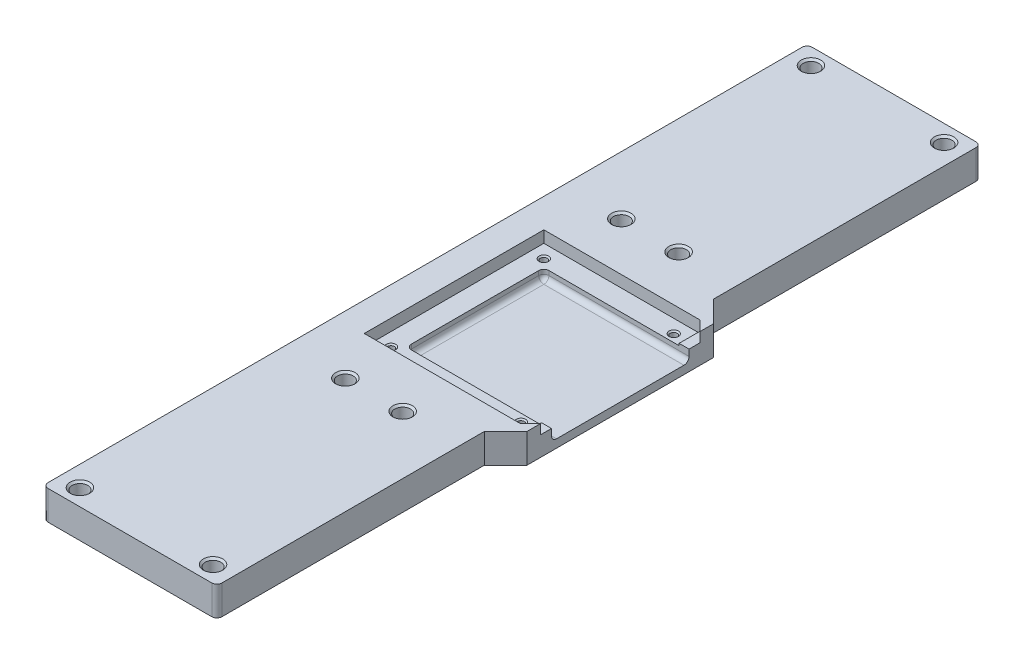
from build123d import *

# Parameters (mm, degrees)
BOSS_EXTRUDE1_DEPTH     = 11.5
SKETCH4_R               = 3.075
CUT_EXTRUDE1_DEPTH      = 6
BOSS_EXTRUDE3_DEPTH     = 11.5
CUT_EXTRUDE6_DEPTH      = 4.6
CUT_EXTRUDE3_DEPTH      = 157.057233091
CUT_EXTRUDE3_DEPTH_BACK = 3.7
SKETCH24_W              = 57
SKETCH24_H              = 54
SKETCH25_R              = 1.35
CUT_EXTRUDE4_DEPTH      = 5
CHAMFER4_SIZE           = 0.5
FILLET1_R               = 2
BOSS_EXTRUDE2_DEPTH     = 0.8
CHAMFER5_SIZE           = 0.75


with BuildPart() as part:
    # Sketch1 → Boss-Extrude1 (new body)
    with BuildSketch(Plane(origin=(0, 0, 0), x_dir=(1, 0, 0), z_dir=(0, 1, 0))):
        with BuildLine():
            Line((-34.125, 135), (-34.125, -135))
            Line((-34.125, -135), (-34.125, -148))
            ThreePointArc((-34.125, -148), (-33.539213562, -149.414213562), (-32.125, -150))
            Line((-32.125, -150), (32.125, -150))
            ThreePointArc((32.125, -150), (33.539213562, -149.414213562), (34.125, -148))
            Line((34.125, -148), (34.125, -135))
            Line((34.125, -135), (34.125, 135))
            Line((34.125, 135), (34.125, 148))
            ThreePointArc((34.125, 148), (33.539213562, 149.414213562), (32.125, 150))
            Line((32.125, 150), (-32.125, 150))
            ThreePointArc((-32.125, 150), (-33.539213562, 149.414213562), (-34.125, 148))
            Line((-34.125, 148), (-34.125, 135))
        make_face()
    extrude(amount=BOSS_EXTRUDE1_DEPTH)

    # Sketch4 → Cut-Extrude1 (cut)
    with BuildSketch(Plane(origin=(0, 11.5, 0), x_dir=(1, 0, 0), z_dir=(0, 1, 0))):
        with Locations(Location((-26.125, -143.5, 0), (0, 0, 270))):
            Circle(SKETCH4_R)
        with Locations(Location((26.125, -143.5, 0), (0, 0, 270))):
            Circle(SKETCH4_R)
        with Locations(Location((26.125, 143.5, 0), (0, 0, 270))):
            Circle(SKETCH4_R)
        with Locations(Location((-26.125, 143.5, 0), (0, 0, 270))):
            Circle(SKETCH4_R)
        with Locations(Location((-11.25, -54.175, 0), (0, 0, 270))):
            Circle(SKETCH4_R)
        with Locations(Location((11.25, -54.175, 0), (0, 0, 270))):
            Circle(SKETCH4_R)
        with Locations(Location((11.25, 54.175, 0), (0, 0, 270))):
            Circle(SKETCH4_R)
        with Locations(Location((-11.25, 54.175, 0), (0, 0, 270))):
            Circle(SKETCH4_R)
    extrude(amount=-CUT_EXTRUDE1_DEPTH, mode=Mode.SUBTRACT)

    # Sketch27 → Boss-Extrude3 (add)
    with BuildSketch(Plane(origin=(0, 11.5, 0), x_dir=(1, 0, 0), z_dir=(0, 1, 0))):
        Polygon((34.125, 45), (42.5, 36.625), (42.5, -36.625), (34.125, -45), align=None)
    extrude(amount=-BOSS_EXTRUDE3_DEPTH)

    # Sketch21 → Cut-Extrude6 (cut)
    with BuildSketch(Plane(origin=(0, 11.5, 0), x_dir=(1, 0, 0), z_dir=(0, 1, 0))):
        Polygon((42.5, 31.353553391), (42.5, -31.353553391), (38.603553391, -35.25), (-22.75, -35.25), (-22.75, 35.25), (38.603553391, 35.25), align=None)
    extrude(amount=-CUT_EXTRUDE6_DEPTH, mode=Mode.SUBTRACT)

    # Sketch24 → Cut-Extrude3 (cut, two sides: drawn at the far end of the back side and taken through both)
    with BuildSketch(Plane(origin=(0, 6.9, 0), x_dir=(1, 0, 0), z_dir=(0, 1, 0)).offset(-CUT_EXTRUDE3_DEPTH_BACK)):
        with Locations((14, 0)):
            Rectangle(SKETCH24_W, SKETCH24_H)
    extrude(amount=CUT_EXTRUDE3_DEPTH + CUT_EXTRUDE3_DEPTH_BACK, mode=Mode.SUBTRACT)

    # Sketch25 → Cut-Extrude4 (cut)
    with BuildSketch(Plane(origin=(0, 6.9, 0), x_dir=(1, 0, 0), z_dir=(0, 1, 0))):
        with Locations(Location((33.5, 30, 0), (0, 0, 270))):
            Circle(SKETCH25_R)
        with Locations(Location((-17.5, 30, 0), (0, 0, 270))):
            Circle(SKETCH25_R)
        with Locations(Location((33.5, -30, 0), (0, 0, 270))):
            Circle(SKETCH25_R)
        with Locations(Location((-17.5, -30, 0), (0, 0, 270))):
            Circle(SKETCH25_R)
    extrude(amount=-CUT_EXTRUDE4_DEPTH, mode=Mode.SUBTRACT)

    # Chamfer4
    chamfer4_edges = [part.edges().sort_by_distance(p)[0] for p in [
        (-17.5, 6.9, -31.35),
        (33.5, 6.9, 28.65),
        (-17.5, 6.9, 28.65),
        (33.5, 6.9, -31.35),
    ]]
    chamfer(chamfer4_edges, length=CHAMFER4_SIZE)

    # Fillet1
    fillet1_edges = [part.edges().sort_by_distance(p)[0] for p in [
        (14, 3.2, -27),
        (-14.5, 5.05, -27),
        (-14.5, 3.2, 0),
        (-14.5, 5.05, 27),
        (14, 3.2, 27),
    ]]
    fillet(fillet1_edges, radius=FILLET1_R)

    # Sketch26 → Boss-Extrude2 (add)
    with BuildSketch(Plane(origin=(0, 6.9, 0), x_dir=(1, 0, 0), z_dir=(0, 1, 0))):
        Polygon((38.603553391, 35.25), (38.603553391, 27), (42.5, 27), (42.5, 31.353553391), align=None)
        Polygon((42.5, -31.353553391), (38.603553391, -35.25), (38.603553391, -27), (42.5, -27), align=None)
    extrude(amount=BOSS_EXTRUDE2_DEPTH)

    # Chamfer5
    chamfer5_edges = [part.edges().sort_by_distance(p)[0] for p in [
        (26.125, 11.5, 140.425),
        (26.125, 11.5, -146.575),
        (-11.25, 11.5, 51.1),
        (11.25, 11.5, 51.1),
        (-11.25, 11.5, -57.25),
        (11.25, 11.5, -57.25),
        (-26.125, 11.5, -146.575),
        (-26.125, 11.5, 140.425),
    ]]
    chamfer(chamfer5_edges, length=CHAMFER5_SIZE)


solid = part.part
